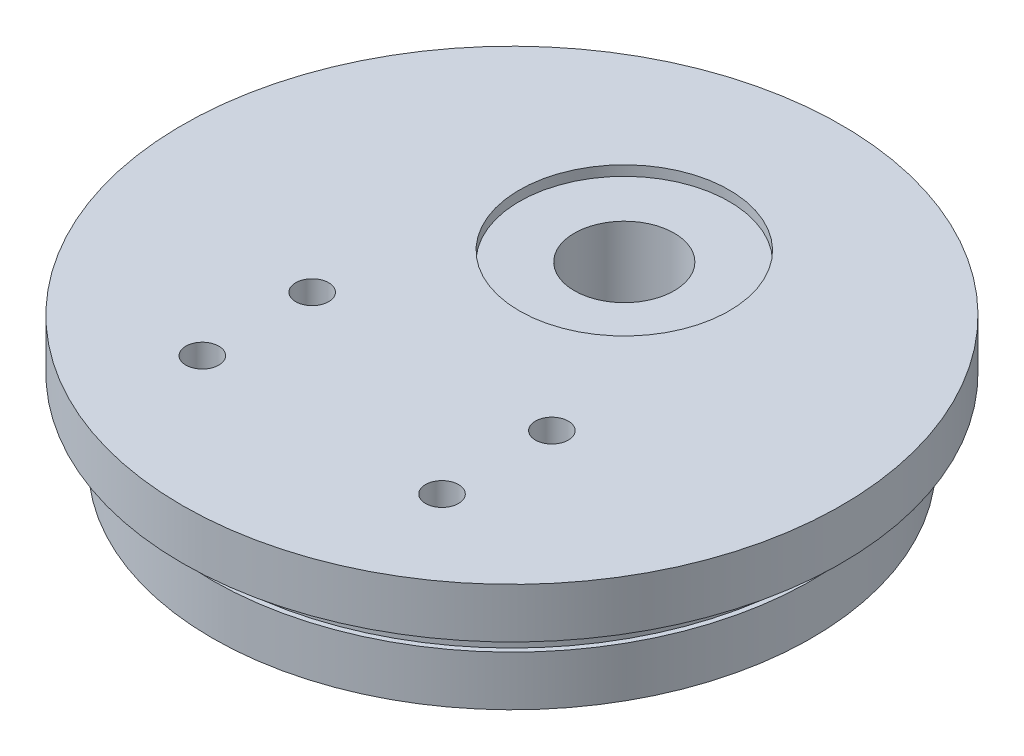
from build123d import *

# Parameters (mm, degrees)
SCHIZZO2_R                      = 5
TAGLIO_ESTRUSIONE1_DEPTH        = 49.445846055
PREFORO_DA_MASCHIARE_M4_1_D     = 3.3
PREFORO_DA_MASCHIARE_M4_1_DEPTH = 5
PREFORO_DA_MASCHIARE_M4_1_TIP   = 0.991420021
PREFORO_DA_MASCHIARE_M4_2_D     = 3.3
PREFORO_DA_MASCHIARE_M4_2_DEPTH = 6
PREFORO_DA_MASCHIARE_M4_2_TIP   = 0.991420021
SCHIZZO9_W                      = 0.5
SCHIZZO9_H                      = 3
SCHIZZO10_R                     = 10.5
TAGLIO_ESTRUSIONE3_DEPTH        = 1


with BuildPart() as part:
    # Schizzo1 → Rivoluzione1 (revolve)
    with BuildSketch(Plane.XY, mode=Mode.PRIVATE) as rivoluzione1_sk:
        Polygon((0, 0), (-33, 0), (-33, -5), (-30, -5), (-30, -13), (0, -13), align=None)
    revolve(rivoluzione1_sk.sketch.rotate(Axis((0, 0, 0), (0, -1, 0)), 270), axis=Axis((0, 0, 0), (0, -1, 0)))

    # Schizzo2 → Taglio-Estrusione1 (cut, through all)
    with BuildSketch(Plane(origin=(0, 0, 0), x_dir=(1, 0, 0), z_dir=(0, 1, 0))):
        with Locations(Location((0, 11.25, 0), (0, 0, 270))):
            Circle(SCHIZZO2_R)
    extrude(amount=-TAGLIO_ESTRUSIONE1_DEPTH, mode=Mode.SUBTRACT)

    # Preforo da maschiare M4-1
    with Locations(Plane.XZ.offset(13)):
        with Locations((18.75, -14), (-18.75, -14), (18.75, 0), (-18.75, 0), (18.75, 14), (-18.75, 14)):
            Hole(PREFORO_DA_MASCHIARE_M4_1_D / 2, depth=PREFORO_DA_MASCHIARE_M4_1_DEPTH)
            with Locations((0, 0, -(PREFORO_DA_MASCHIARE_M4_1_DEPTH + PREFORO_DA_MASCHIARE_M4_1_TIP / 2))):  # 118° drill point
                Cone(0, PREFORO_DA_MASCHIARE_M4_1_D / 2, PREFORO_DA_MASCHIARE_M4_1_TIP, mode=Mode.SUBTRACT)

    # Preforo da maschiare M4-2
    with Locations(Plane(origin=(-1.316930137, 0, -6.397886151), x_dir=(-1, 0, 0), z_dir=(0, 1, 0))):
        with Locations((-13.316930137, 14.397886151), (10.683069863, 14.397886151), (-13.316930137, 25.397886151), (10.683069863, 25.397886151)):
            Hole(PREFORO_DA_MASCHIARE_M4_2_D / 2, depth=PREFORO_DA_MASCHIARE_M4_2_DEPTH)
            with Locations((0, 0, -(PREFORO_DA_MASCHIARE_M4_2_DEPTH + PREFORO_DA_MASCHIARE_M4_2_TIP / 2))):  # 118° drill point
                Cone(0, PREFORO_DA_MASCHIARE_M4_2_D / 2, PREFORO_DA_MASCHIARE_M4_2_TIP, mode=Mode.SUBTRACT)

    # Schizzo9 → Taglia-Rivoluzione1 (revolve, cut)
    with BuildSketch(Plane.XY, mode=Mode.PRIVATE) as taglia_rivoluzione1_sk:
        with Locations((-29.75, -6.5)):
            Rectangle(SCHIZZO9_W, SCHIZZO9_H)
    revolve(taglia_rivoluzione1_sk.sketch.rotate(Axis((0, 0, 0), (0, -1, 0)), 270), axis=Axis((0, 0, 0), (0, -1, 0)), mode=Mode.SUBTRACT)

    # Schizzo10 → Taglio-Estrusione3 (cut)
    with BuildSketch(Plane(origin=(0, 0, 0), x_dir=(1, 0, 0), z_dir=(0, 1, 0))):
        with Locations(Location((0, 11.25, 0), (0, 0, 270))):
            Circle(SCHIZZO10_R)
    extrude(amount=-TAGLIO_ESTRUSIONE3_DEPTH, mode=Mode.SUBTRACT)


solid = part.part
